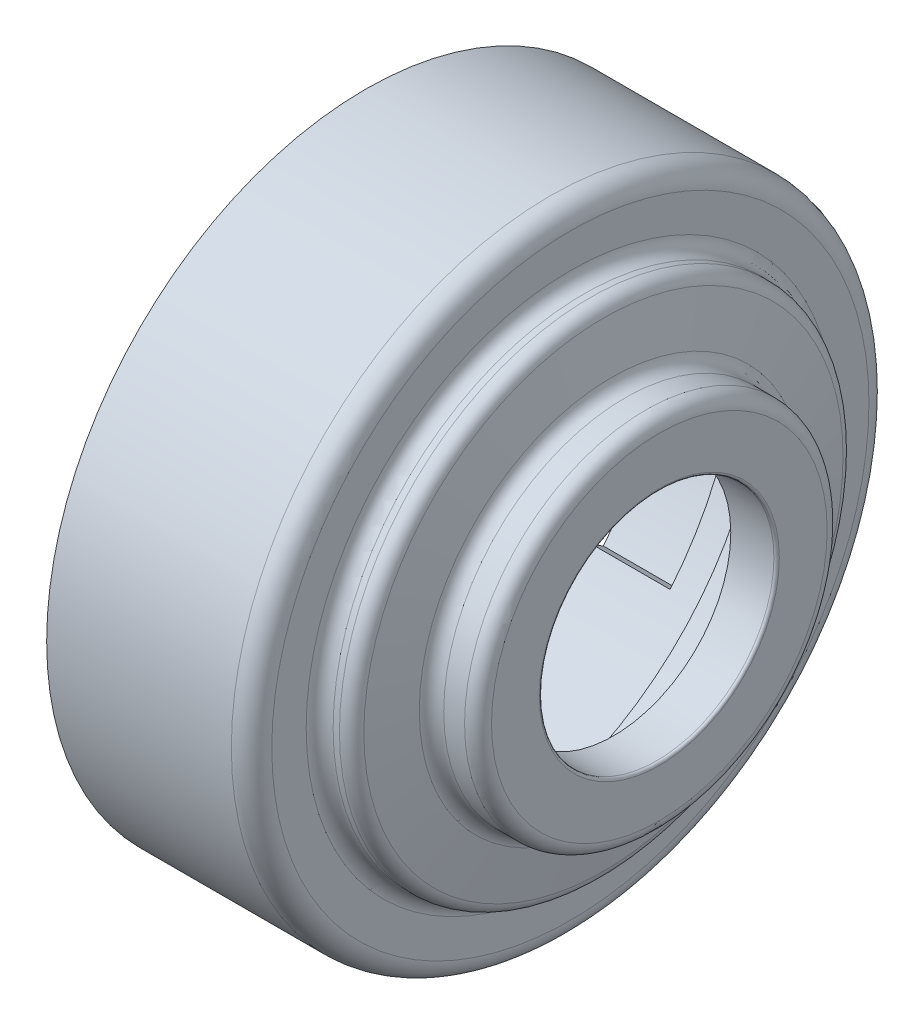
from build123d import *

# Parameters (mm, degrees)
FILLET_1_R               = 0.2
FILLET_2_R               = 1
FILLET_3_R               = 1.5
CUT_EXTRUDE_START        = -5.7
CUT_EXTRUDE_2_DEPTH      = 5.7
SKETCH_5_W               = 2.4
SKETCH_5_H               = 1.508146796
CUT_REVOLVE_1_ANGLE      = 28
PATTERN_CIRCULAR_1_COUNT = 3


with BuildPart() as part:
    # 草图2 → 旋转1 (revolve)
    with BuildSketch(Plane.XY, mode=Mode.PRIVATE) as revolve_1_sk:
        Polygon((-14, 22), (-6, 22), (-6, 21.6), (0, 21.6), (0, 17.4), (2.5, 17.4), (3.408083951, 12.25), (6.6, 12.25), (6.6, 9.4), (4.4, 9.4), (4.4, 8.7), (7.8, 8.7), (7.8, 13.45), (4.415003508, 13.45), (3.506919557, 18.6), (1.2, 18.6), (1.2, 23.65), (-14, 23.65), align=None)
    revolve(revolve_1_sk.sketch.rotate(Axis((-36.936605317, 0, 0), (1, 0, 0)), 90), axis=Axis((-36.936605317, 0, 0), (1, 0, 0)))

    # 圆角1
    fillet_1_edges = [part.edges().sort_by_distance(p)[0] for p in [
        (0, 0, -21.6),
        (0, 0, -17.4),
        (2.5, 0, -17.4),
        (6.6, 0, -12.25),
        (7.8, 0, -8.7),
    ]]
    fillet(fillet_1_edges, radius=FILLET_1_R)

    # 圆角2
    fillet_2_edges = [part.edges().sort_by_distance(p)[0] for p in [
        (7.8, 0, -13.45),
        (4.415003508, 0, -13.45),
        (3.506919557, 0, -18.6),
        (1.2, 0, -18.6),
    ]]
    fillet(fillet_2_edges, radius=FILLET_2_R)

    # 圆角3
    fillet_3_edges = [part.edges().sort_by_distance(p)[0] for p in [
        (3.408083951, 0, -12.25),
        (1.2, 0, -23.65),
    ]]
    fillet(fillet_3_edges, radius=FILLET_3_R)

    # 草图4 → 切除-拉伸2 (cut)
    with BuildSketch(Plane.ZY.offset(14).offset(CUT_EXTRUDE_START)):
        with BuildLine():
            Line((-3.75, 22.540186335), (-3.75, 21.678041886))
            ThreePointArc((-3.75, 21.678041886), (0, 22), (3.75, 21.678041886))
            Line((3.75, 21.678041886), (3.75, 22.540186335))
            ThreePointArc((3.75, 22.540186335), (0, 22.85), (-3.75, 22.540186335))
        make_face()
    cut_extrude_2 = extrude(amount=CUT_EXTRUDE_2_DEPTH, mode=Mode.SUBTRACT)

    # 草图5 → 切除-旋转1 (revolve, cut)
    with BuildSketch(Plane.XY):
        with Locations((-9.5, 22.095926602)):
            Rectangle(SKETCH_5_W, SKETCH_5_H)
    cut_revolve_1 = revolve(axis=Axis((16.624194515, 0, 0), (1, 0, 0)), revolution_arc=CUT_REVOLVE_1_ANGLE, mode=Mode.SUBTRACT)

    # 阵列(圆周)1: 切除-拉伸2, 切除-旋转1 ×3 about axis
    pattern_circular_1_axis = Axis((0, 0, 0), (1, 0, 0))
    add([cut_extrude_2.rotate(pattern_circular_1_axis, i * 360 / PATTERN_CIRCULAR_1_COUNT) for i in range(1, PATTERN_CIRCULAR_1_COUNT)], mode=Mode.SUBTRACT)
    add([cut_revolve_1.rotate(pattern_circular_1_axis, i * 360 / PATTERN_CIRCULAR_1_COUNT) for i in range(1, PATTERN_CIRCULAR_1_COUNT)], mode=Mode.SUBTRACT)


solid = part.part
